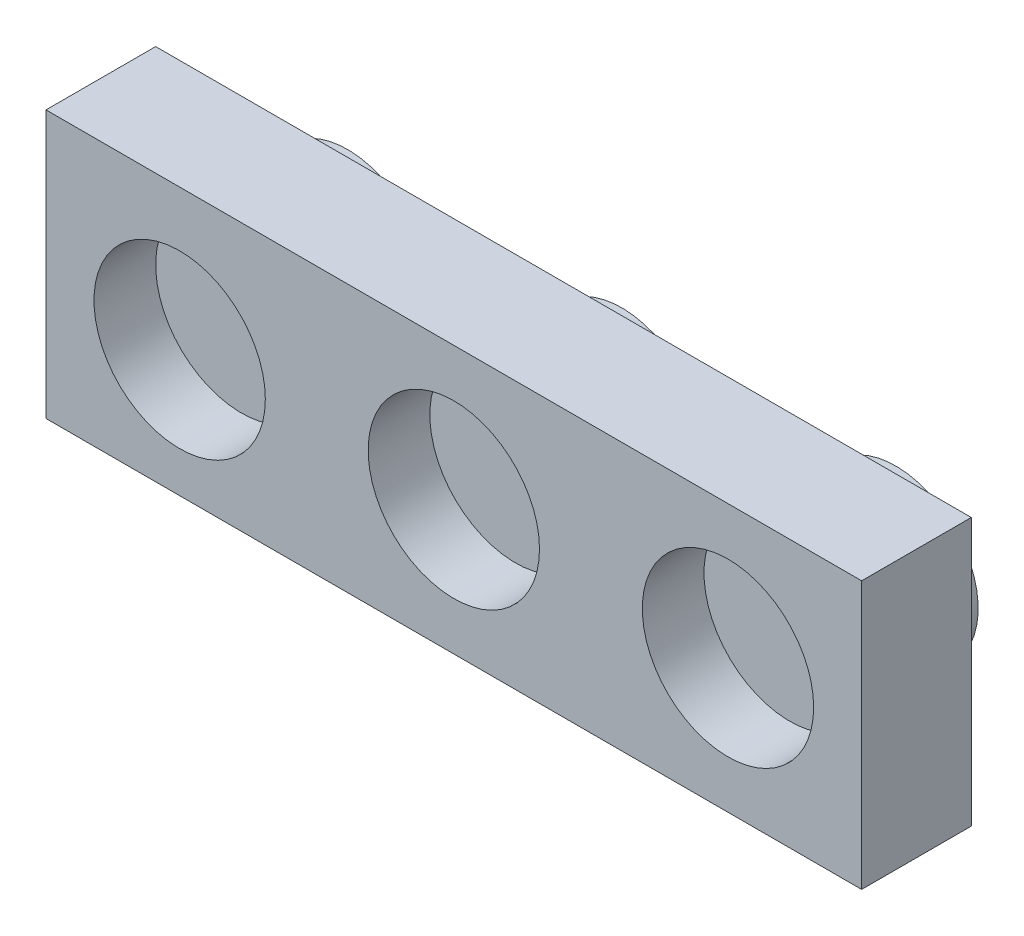
from build123d import *

# Parameters (mm, degrees)
SKETCH_1_W          = 23.8
SKETCH_1_H          = 7.8
EXTRUDE_1_DEPTH     = 3.2
SKETCH_2_R          = 2.4
EXTRUDE_2_DEPTH     = 1.7
SKETCH_3_R          = 2.5
CUT_EXTRUDE_1_DEPTH = 1.8


with BuildPart() as part:
    # Эскиз1 → Бобышка-Вытянуть1 (new body)
    with BuildSketch(Plane.XY):
        Rectangle(SKETCH_1_W, SKETCH_1_H)
    extrude(amount=EXTRUDE_1_DEPTH)

    # Эскиз2 → Бобышка-Вытянуть2 (add)
    with BuildSketch(Plane(origin=(0, 0, 0), x_dir=(-1, 0, 0), z_dir=(0, 0, -1))):
        Circle(SKETCH_2_R)
        with Locations((8, 0)):
            Circle(SKETCH_2_R)
        with Locations((-8, 0)):
            Circle(SKETCH_2_R)
    extrude(amount=EXTRUDE_2_DEPTH)

    # Эскиз3 → Вырез-Вытянуть1 (cut)
    with BuildSketch(Plane.XY.offset(3.2)):
        Circle(SKETCH_3_R)
        with Locations((-8, -0.211129939)):
            Circle(SKETCH_3_R)
        with Locations((8, 0)):
            Circle(SKETCH_3_R)
    extrude(amount=-CUT_EXTRUDE_1_DEPTH, mode=Mode.SUBTRACT)


solid = part.part
